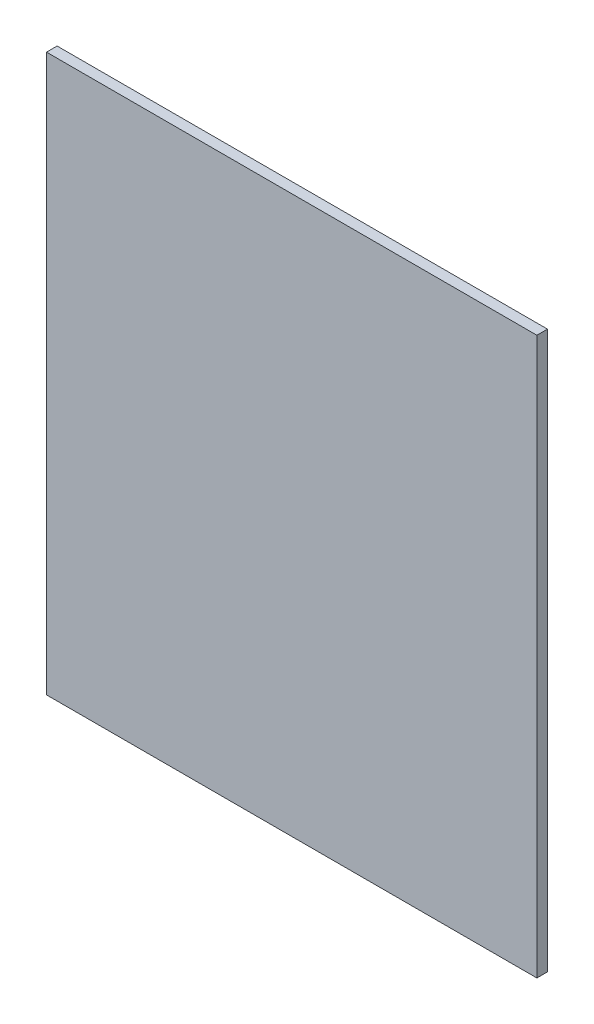
from build123d import *

# Parameters (mm, degrees)
SKETCH1_W           = 92.5
SKETCH1_H           = 105
BOSS_EXTRUDE1_DEPTH = 2


with BuildPart() as part:
    # Sketch1 → Boss-Extrude1 (new body)
    with BuildSketch(Plane.XY):
        Rectangle(SKETCH1_W, SKETCH1_H)
    extrude(amount=BOSS_EXTRUDE1_DEPTH)


solid = part.part
